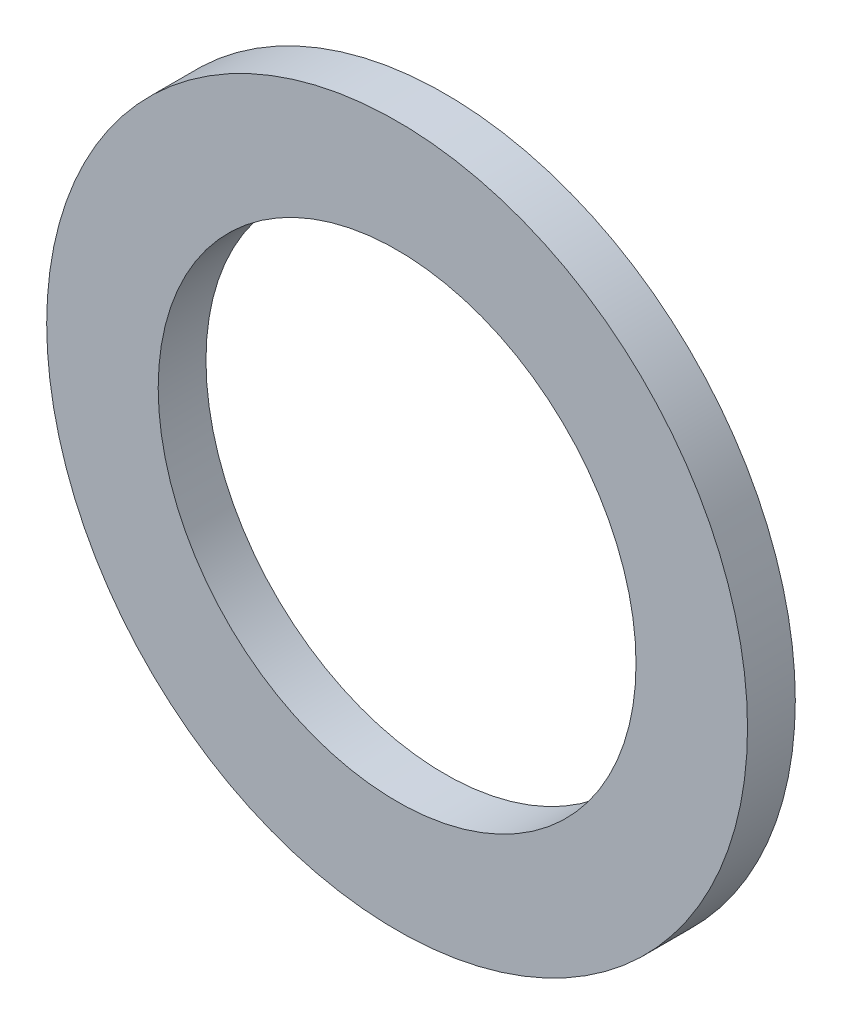
from build123d import *

# Parameters (mm, degrees)
SKETCH_1_R          = 11
EXTRUDE_1_DEPTH     = 1.5
SKETCH_2_R          = 7.5
CUT_EXTRUDE_1_DEPTH = 1.5


with BuildPart() as part:
    # Эскиз1 → Вытянуть1 (new body)
    with BuildSketch(Plane.XY):
        Circle(SKETCH_1_R)
    extrude(amount=EXTRUDE_1_DEPTH)

    # Эскиз2 → Вырез-Вытянуть1 (cut)
    with BuildSketch(Plane.XY.offset(1.5)):
        Circle(SKETCH_2_R)
    extrude(amount=-CUT_EXTRUDE_1_DEPTH, mode=Mode.SUBTRACT)


solid = part.part
